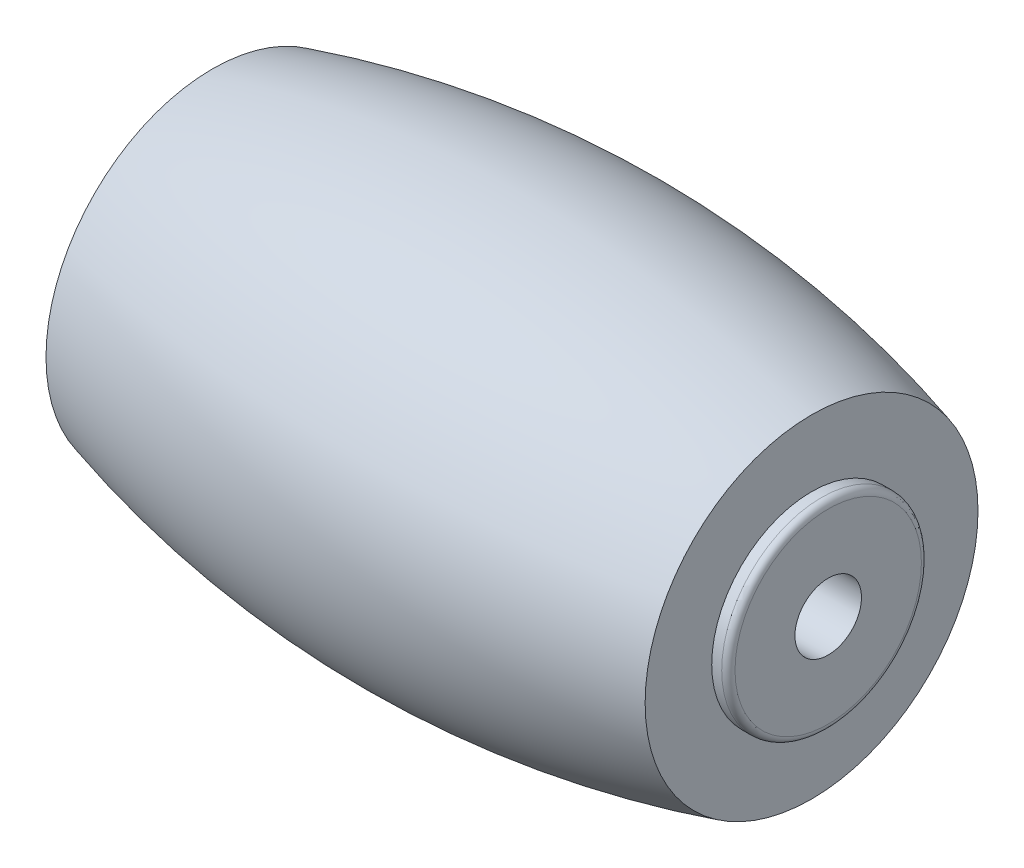
from build123d import *

# Parameters (mm, degrees)
SKETCH3_R           = 3
BOSS_EXTRUDE1_DEPTH = 0.5
SKETCH4_R           = 1
CUT_EXTRUDE2_DEPTH  = 21.955114523
FILLET1_R           = 0.2


with BuildPart() as part:
    # Sketch1 → Revolve1 (revolve)
    with BuildSketch(Plane(origin=(0, 0, 0), x_dir=(1, 0, 0), z_dir=(0, 1, 0))):
        with BuildLine():
            Line((0, 0), (-9, 0))
            Line((-9, 0), (-9, 5))
            ThreePointArc((-9, 5), (0, 6.249672879), (9, 5))
            Line((9, 5), (9, 0))
            Line((9, 0), (0, 0))
        make_face()
    revolve(axis=Axis((0, 0, 0), (-1, 0, 0)))

    # Sketch3 → Boss-Extrude1 (add)
    with BuildSketch(Plane(origin=(9, 0, 0), x_dir=(0, 0, -1), z_dir=(1, 0, 0))):
        Circle(SKETCH3_R)
    boss_extrude1 = extrude(amount=BOSS_EXTRUDE1_DEPTH)

    # Mirror1: Boss-Extrude1 across plane
    add(boss_extrude1.mirror(Plane(origin=(0, 0, 0), x_dir=(0, 0, 1), z_dir=(1, 0, 0))))

    # Sketch4 → Cut-Extrude2 (cut, through all)
    with BuildSketch(Plane.ZY.offset(9.5)):
        Circle(SKETCH4_R)
    extrude(amount=-CUT_EXTRUDE2_DEPTH, mode=Mode.SUBTRACT)

    # Fillet1
    fillet1_edges = [part.edges().sort_by_distance(p)[0] for p in [
        (9.5, 0, 3),
        (-9.5, 0, 3),
    ]]
    fillet(fillet1_edges, radius=FILLET1_R)


solid = part.part
